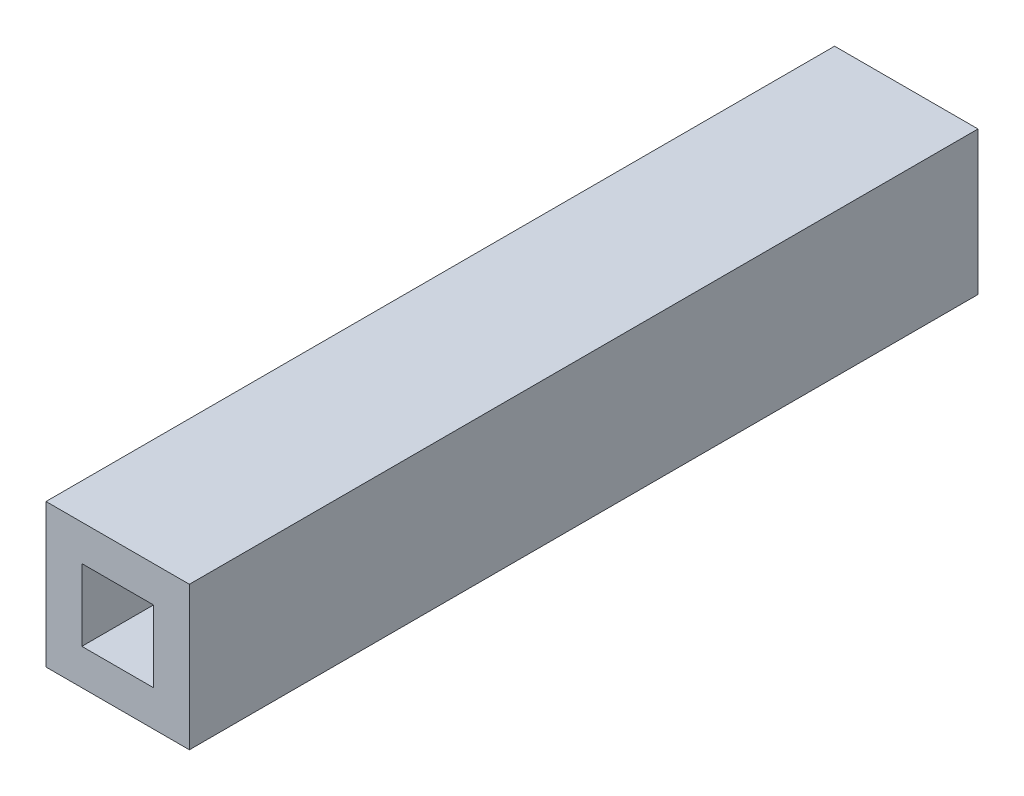
from build123d import *

# Parameters (mm, degrees)
SKETCH1_W           = 20
SKETCH1_H           = 20
SKETCH1_W_2         = 10
SKETCH1_H_2         = 10
EXTRUDE_THIN1_DEPTH = 110


with BuildPart() as part:
    # Sketch1 → Extrude-Thin1 (new body)
    with BuildSketch(Plane.XY):
        Rectangle(SKETCH1_W, SKETCH1_H)
        Rectangle(SKETCH1_W_2, SKETCH1_H_2, mode=Mode.SUBTRACT)
    extrude(amount=EXTRUDE_THIN1_DEPTH)


solid = part.part
